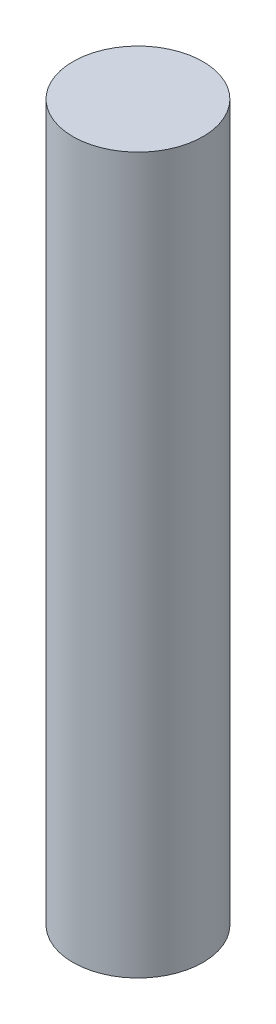
from build123d import *

# Parameters (mm, degrees)
CROQUIS1_R              = 100
SALIENTE_EXTRUIR1_DEPTH = 1100


with BuildPart() as part:
    # Croquis1 → Saliente-Extruir1 (new body)
    with BuildSketch(Plane(origin=(0, 0, 0), x_dir=(1, 0, 0), z_dir=(0, 1, 0))):
        with Locations(Location((0, 0, 0), (0, 0, 270))):
            Circle(CROQUIS1_R)
    extrude(amount=SALIENTE_EXTRUIR1_DEPTH)


solid = part.part
